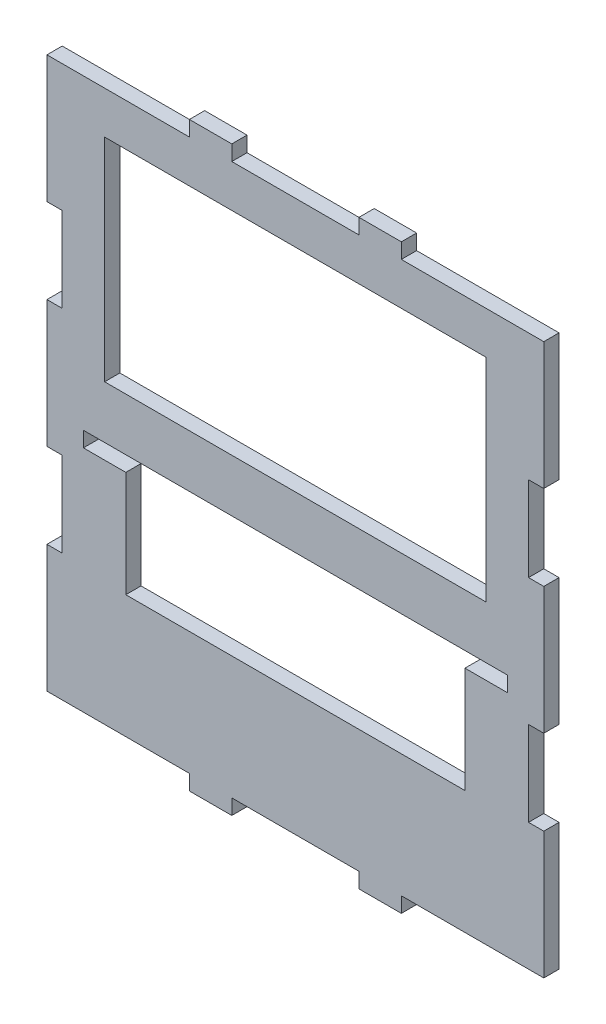
from build123d import *

# Parameters (mm, degrees)
SKETCH1_W           = 148.844
SKETCH1_H           = 174.244
BOSS_EXTRUDE1_DEPTH = 4.572
SKETCH2_W           = 42.672
SKETCH2_H           = 4.572
SKETCH2_W_2         = 38.1
CUT_EXTRUDE1_DEPTH  = 45.72
SKETCH3_W           = 4.572
SKETCH3_H           = 25.4
CUT_EXTRUDE2_DEPTH  = 45.72
SKETCH4_W           = 114.3
SKETCH4_H           = 63.5
SKETCH4_W_2         = 101.6
SKETCH4_H_2         = 31.75
CUT_EXTRUDE3_DEPTH  = 4.572
SKETCH5_W           = 127
SKETCH5_H           = 4.572
CUT_EXTRUDE4_DEPTH  = 4.572


with BuildPart() as part:
    # Sketch1 → Boss-Extrude1 (new body)
    with BuildSketch(Plane.XY):
        with Locations((74.422, 87.122)):
            Rectangle(SKETCH1_W, SKETCH1_H)
    extrude(amount=BOSS_EXTRUDE1_DEPTH)

    # Sketch2 → Cut-Extrude1 (cut)
    with BuildSketch(Plane.XY.offset(4.572)):
        with Locations((21.336, 2.286)):
            Rectangle(SKETCH2_W, SKETCH2_H)
        with Locations((74.422, 2.286)):
            Rectangle(SKETCH2_W_2, SKETCH2_H)
        with Locations((127.508, 2.286)):
            Rectangle(SKETCH2_W, SKETCH2_H)
        with Locations((21.336, 171.958)):
            Rectangle(SKETCH2_W, SKETCH2_H)
        with Locations((127.508, 171.958)):
            Rectangle(SKETCH2_W, SKETCH2_H)
        with Locations((74.422, 171.958)):
            Rectangle(SKETCH2_W_2, SKETCH2_H)
    extrude(amount=-CUT_EXTRUDE1_DEPTH, mode=Mode.SUBTRACT)

    # Sketch3 → Cut-Extrude2 (cut)
    with BuildSketch(Plane.XY.offset(4.572)):
        with Locations((146.558, 55.372)):
            Rectangle(SKETCH3_W, SKETCH3_H)
        with Locations((2.286, 55.372)):
            Rectangle(SKETCH3_W, SKETCH3_H)
        with Locations((146.558, 118.872)):
            Rectangle(SKETCH3_W, SKETCH3_H)
        with Locations((2.286, 118.872)):
            Rectangle(SKETCH3_W, SKETCH3_H)
    extrude(amount=-CUT_EXTRUDE2_DEPTH, mode=Mode.SUBTRACT)

    # Sketch4 → Cut-Extrude3 (cut)
    with BuildSketch(Plane(origin=(0, 0, 0), x_dir=(-1, 0, 0), z_dir=(0, 0, -1))):
        with Locations((-74.422, 125.222)):
            Rectangle(SKETCH4_W, SKETCH4_H)
        with Locations((-74.422, 57.277)):
            Rectangle(SKETCH4_W_2, SKETCH4_H_2)
    extrude(amount=-CUT_EXTRUDE3_DEPTH, mode=Mode.SUBTRACT)

    # Sketch5 → Cut-Extrude4 (cut)
    with BuildSketch(Plane(origin=(0, 0, 0), x_dir=(-1, 0, 0), z_dir=(0, 0, -1))):
        with Locations((-74.422, 75.438)):
            Rectangle(SKETCH5_W, SKETCH5_H)
    extrude(amount=-CUT_EXTRUDE4_DEPTH, mode=Mode.SUBTRACT)


solid = part.part
